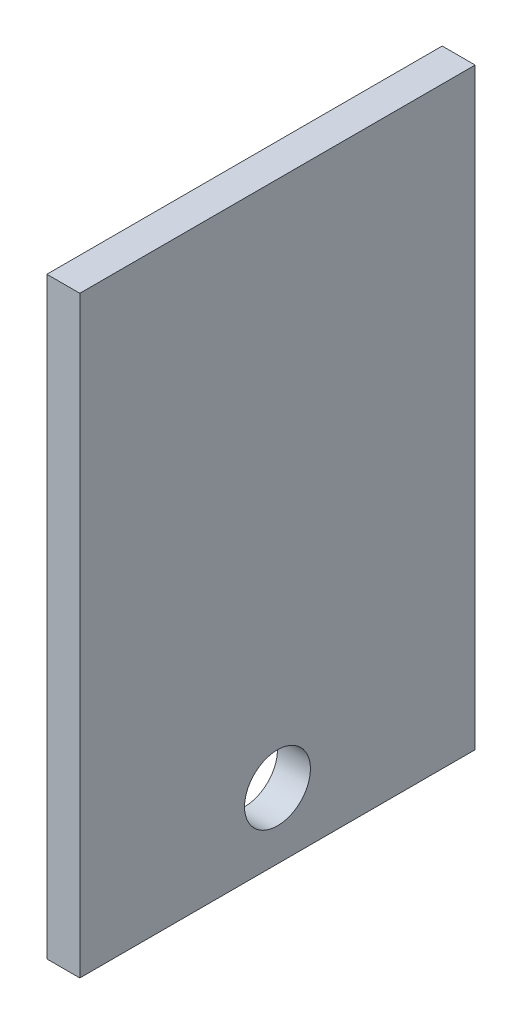
from build123d import *

# Parameters (mm, degrees)
SKETCH1_W           = 304.8
SKETCH1_H           = 304.8
BOSS_EXTRUDE1_DEPTH = 25.4
SKETCH2_R           = 25.4
CUT_EXTRUDE1_DEPTH  = 25.4
SKETCH3_W           = 25.4
SKETCH3_H           = 304.8
BOSS_EXTRUDE2_DEPTH = 152.4


with BuildPart() as part:
    # Sketch1 → Boss-Extrude1 (new body)
    with BuildSketch(Plane(origin=(0, 0, 0), x_dir=(0, 0, -1), z_dir=(1, 0, 0))):
        Rectangle(SKETCH1_W, SKETCH1_H)
    extrude(amount=BOSS_EXTRUDE1_DEPTH)

    # Sketch2 → Cut-Extrude1 (cut)
    with BuildSketch(Plane.ZY):
        with Locations((0, -101.6)):
            Circle(SKETCH2_R)
    extrude(amount=-CUT_EXTRUDE1_DEPTH, mode=Mode.SUBTRACT)

    # Sketch3 → Boss-Extrude2 (add)
    with BuildSketch(Plane(origin=(0, 152.4, 0), x_dir=(1, 0, 0), z_dir=(0, 1, 0))):
        with Locations((12.7, 0)):
            Rectangle(SKETCH3_W, SKETCH3_H)
    extrude(amount=BOSS_EXTRUDE2_DEPTH)


solid = part.part
